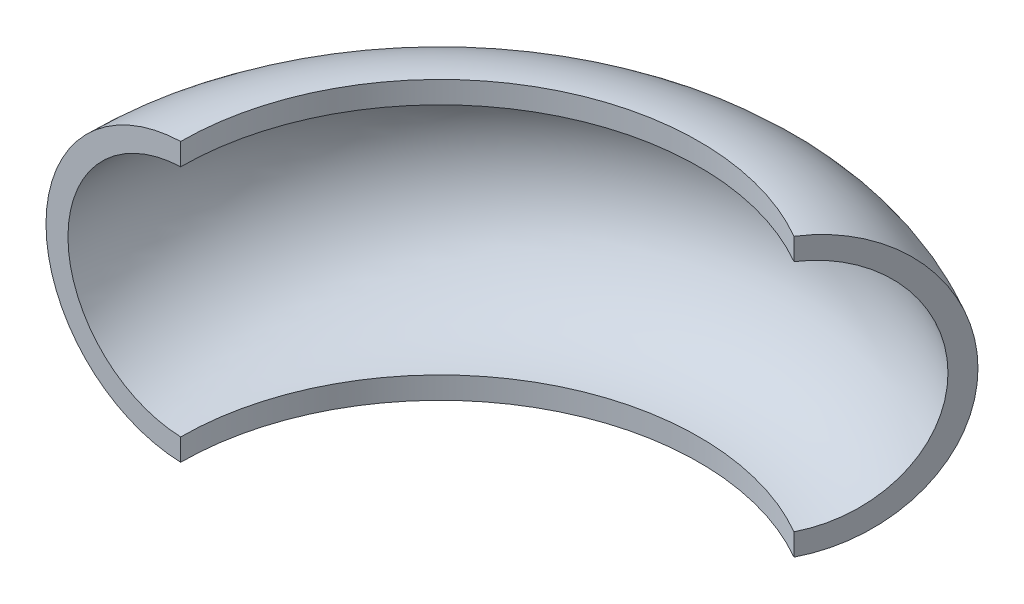
from build123d import *


with BuildPart() as part:
    # Sweep1: sweep along a path in Sketch2
    with BuildLine(Plane(origin=(0, 0, 0), x_dir=(1, 0, 0), z_dir=(0, 1, 0))) as sweep1_path:
        ThreePointArc((44.295, 25.573730174), (14.765, 25.573730174), (0, 0))
    # Sketch1 → Sweep1 (sweep)
    with BuildSketch(Plane.XY):
        with BuildLine():
            Line((-0.5, 16.097236564), (-0.5, 13.550778575))
            ThreePointArc((-0.5, 13.550778575), (-13.56, 0), (-0.5, -13.550778575))
            Line((-0.5, -13.550778575), (-0.5, -16.097236564))
            ThreePointArc((-0.5, -16.097236564), (-16.105, 0), (-0.5, 16.097236564))
        make_face()
    sweep(path=sweep1_path.line)


solid = part.part
